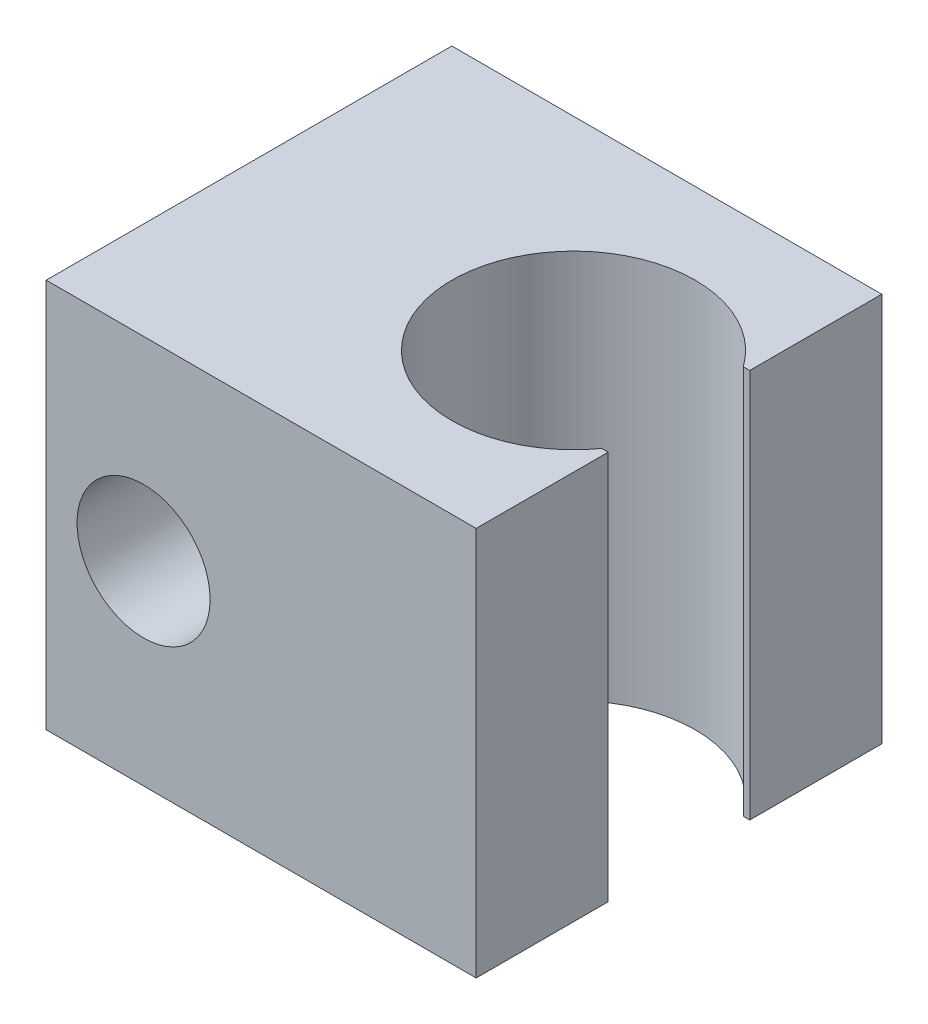
from build123d import *

# Parameters (mm, degrees)
SKETCH1_W           = 22.5
SKETCH1_H           = 25
SKETCH1_R           = 7.5
BOSS_EXTRUDE1_DEPTH = 24
CUT_EXTRUDE4_DEPTH  = 30.807717122
SKETCH7_W           = 10
SKETCH7_H           = 25
BOSS_EXTRUDE2_DEPTH = 24
SKETCH8_R           = 4.1
CUT_EXTRUDE5_DEPTH  = 48


with BuildPart() as part:
    # Sketch1 → Boss-Extrude1 (new body)
    with BuildSketch(Plane(origin=(0, 0, 0), x_dir=(1, 0, 0), z_dir=(0, 1, 0))):
        with Locations((1.25, 0)):
            Rectangle(SKETCH1_W, SKETCH1_H)
        with Locations(Location((0, 0, 0), (0, 0, 270))):
            Circle(SKETCH1_R, mode=Mode.SUBTRACT)
    extrude(amount=BOSS_EXTRUDE1_DEPTH)

    # Sketch5 → Cut-Extrude4 (cut, through all)
    with BuildSketch(Plane.XZ):
        Polygon((12.5, 12.5), (6.5, 12.5), (6.5, 4.363484846), (6.1, 4.363484846), (6.1, -4.363484846), (6.5, -4.363484846), (6.5, -12.5), (12.5, -12.5), align=None)
    extrude(amount=-CUT_EXTRUDE4_DEPTH, mode=Mode.SUBTRACT)

    # Sketch7 → Boss-Extrude2 (add)
    with BuildSketch(Plane.XZ):
        with Locations((-15, 0)):
            Rectangle(SKETCH7_W, SKETCH7_H)
    extrude(amount=-BOSS_EXTRUDE2_DEPTH)

    # Sketch8 → Cut-Extrude5 (cut)
    with BuildSketch(Plane.XY.offset(12.5)):
        with Locations((-14, 12)):
            Circle(SKETCH8_R)
    extrude(amount=-CUT_EXTRUDE5_DEPTH, mode=Mode.SUBTRACT)


solid = part.part
